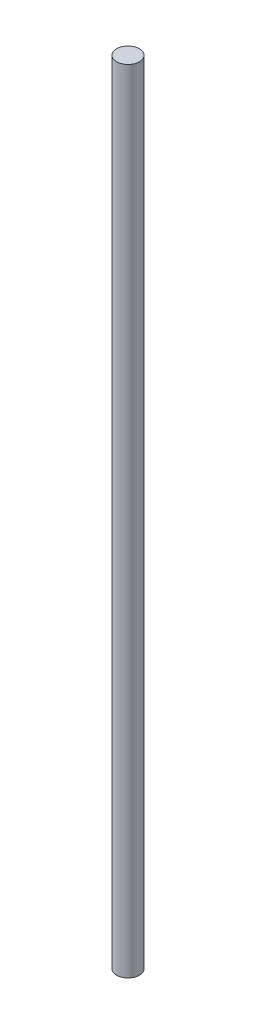
from build123d import *

# Parameters (mm, degrees)
SKETCH1_R           = 34.925
BOSS_EXTRUDE1_DEPTH = 2438.4


with BuildPart() as part:
    # Sketch1 → Boss-Extrude1 (new body)
    with BuildSketch(Plane(origin=(0, 0, 0), x_dir=(1, 0, 0), z_dir=(0, 1, 0))):
        with Locations(Location((0, 0, 0), (0, 0, 90))):
            Circle(SKETCH1_R)
    extrude(amount=BOSS_EXTRUDE1_DEPTH)


solid = part.part
